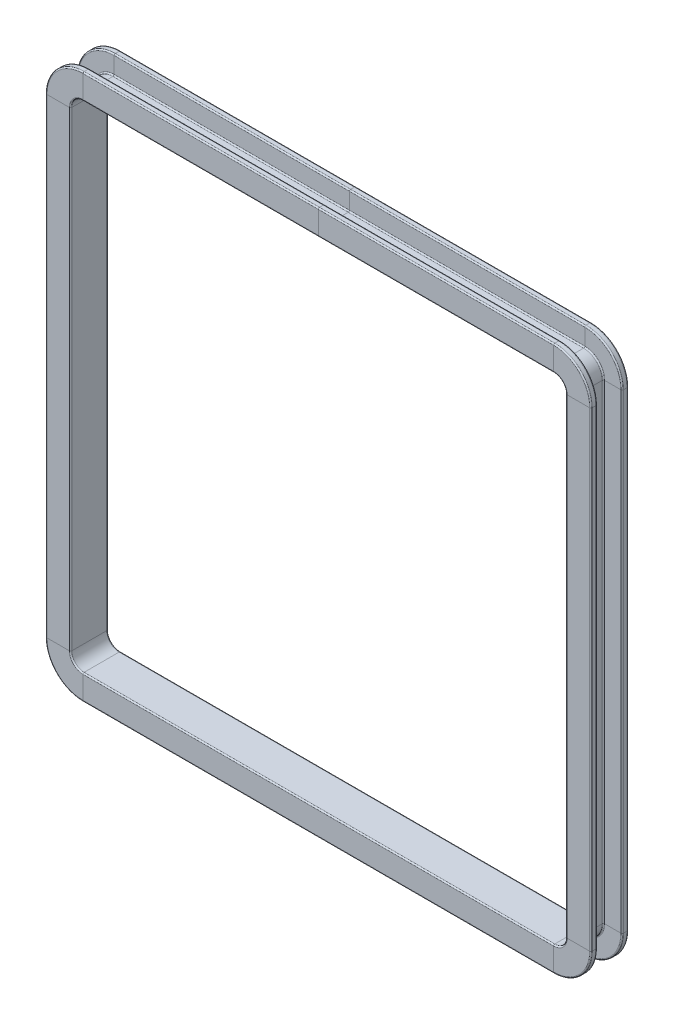
from build123d import *


with BuildPart() as part:
    # Sweep1: sweep along a path in Sketch2
    with BuildLine(Plane.XY) as sweep1_path:
        Line((855, 900), (-855, 900))
        ThreePointArc((-855, 900), (-886.819805153, 886.819805153), (-900, 855))
        Line((-900, 855), (-900, -855))
        ThreePointArc((-900, -855), (-886.819805153, -886.819805153), (-855, -900))
        Line((-855, -900), (855, -900))
        ThreePointArc((855, -900), (886.819805153, -886.819805153), (900, -855))
        Line((900, -855), (900, 855))
        ThreePointArc((900, 855), (886.819805153, 886.819805153), (855, 900))
    # Sketch3 → Sweep1 (sweep)
    with BuildSketch(Plane(origin=(0, 0, 0), x_dir=(0, 0, -1), z_dir=(1, 0, 0))):
        with BuildLine():
            Line((-63.525, 900), (63.525, 900))
            ThreePointArc((63.525, 900), (66.73349702, 901.32900298), (68.0625, 904.5375))
            Line((68.0625, 904.5375), (68.0625, 986.2125))
            ThreePointArc((68.0625, 986.2125), (66.73349702, 989.42099702), (63.525, 990.75))
            Line((63.525, 990.75), (49.9125, 990.75))
            ThreePointArc((49.9125, 990.75), (46.70400298, 989.42099702), (45.375, 986.2125))
            Line((45.375, 986.2125), (45.375, 927.225))
            ThreePointArc((45.375, 927.225), (44.04599702, 924.01650298), (40.8375, 922.6875))
            Line((40.8375, 922.6875), (-40.8375, 922.6875))
            ThreePointArc((-40.8375, 922.6875), (-44.04599702, 924.01650298), (-45.375, 927.225))
            Line((-45.375, 927.225), (-45.375, 986.2125))
            ThreePointArc((-45.375, 986.2125), (-46.70400298, 989.42099702), (-49.9125, 990.75))
            Line((-49.9125, 990.75), (-63.525, 990.75))
            ThreePointArc((-63.525, 990.75), (-66.73349702, 989.42099702), (-68.0625, 986.2125))
            Line((-68.0625, 986.2125), (-68.0625, 904.5375))
            ThreePointArc((-68.0625, 904.5375), (-66.73349702, 901.32900298), (-63.525, 900))
        make_face()
    sweep(path=sweep1_path.line)


solid = part.part
